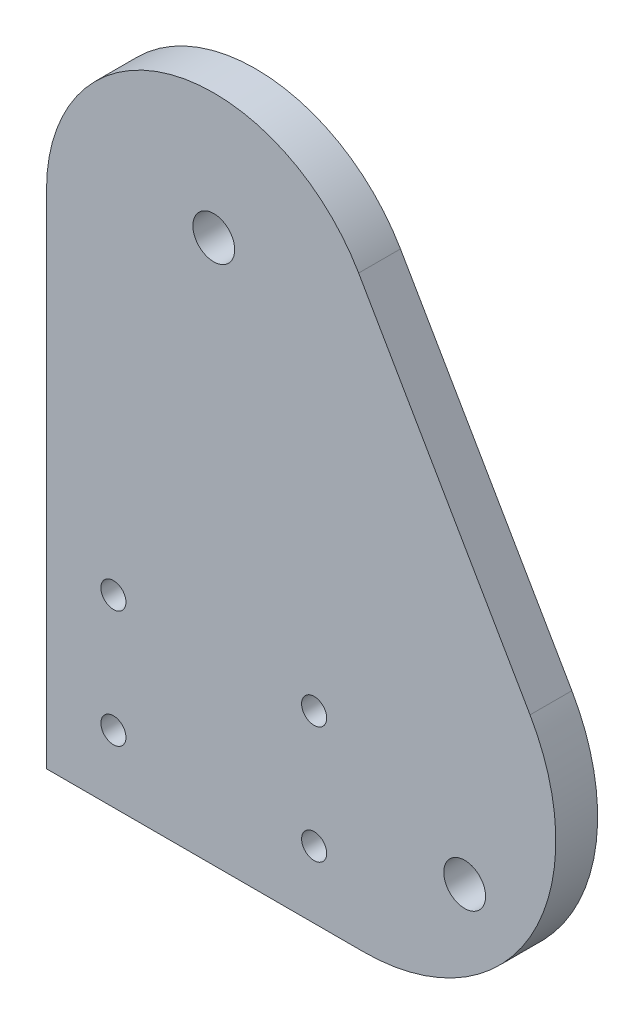
from build123d import *

# Parameters (mm, degrees)
SKETCH_1_R      = 1.5
SKETCH_1_R_2    = 2.5
EXTRUDE_2_DEPTH = 5


with BuildPart() as part:
    # 草圖1 → 填料-伸長2 (new body)
    with BuildSketch(Plane.XY):
        with BuildLine():
            Line((-20, 30), (-20, -30))
            Line((-20, -30), (17.897858345, -30))
            ThreePointArc((17.897858345, -30), (37.816442632, -18.5), (37.816442632, 4.5))
            Line((37.816442632, 4.5), (17.320508076, 40))
            ThreePointArc((17.320508076, 40), (-5.176380902, 49.318516526), (-20, 30))
        make_face()
        with Locations((-12, -8)):
            Circle(SKETCH_1_R, mode=Mode.SUBTRACT)
        with Locations((-12, -22)):
            Circle(SKETCH_1_R, mode=Mode.SUBTRACT)
        with Locations((12, -22)):
            Circle(SKETCH_1_R, mode=Mode.SUBTRACT)
        with Locations((12, -8)):
            Circle(SKETCH_1_R, mode=Mode.SUBTRACT)
        with Locations((0, 35)):
            Circle(SKETCH_1_R_2, mode=Mode.SUBTRACT)
        with Locations((30, -16.961524227)):
            Circle(SKETCH_1_R_2, mode=Mode.SUBTRACT)
    extrude(amount=EXTRUDE_2_DEPTH)


solid = part.part
